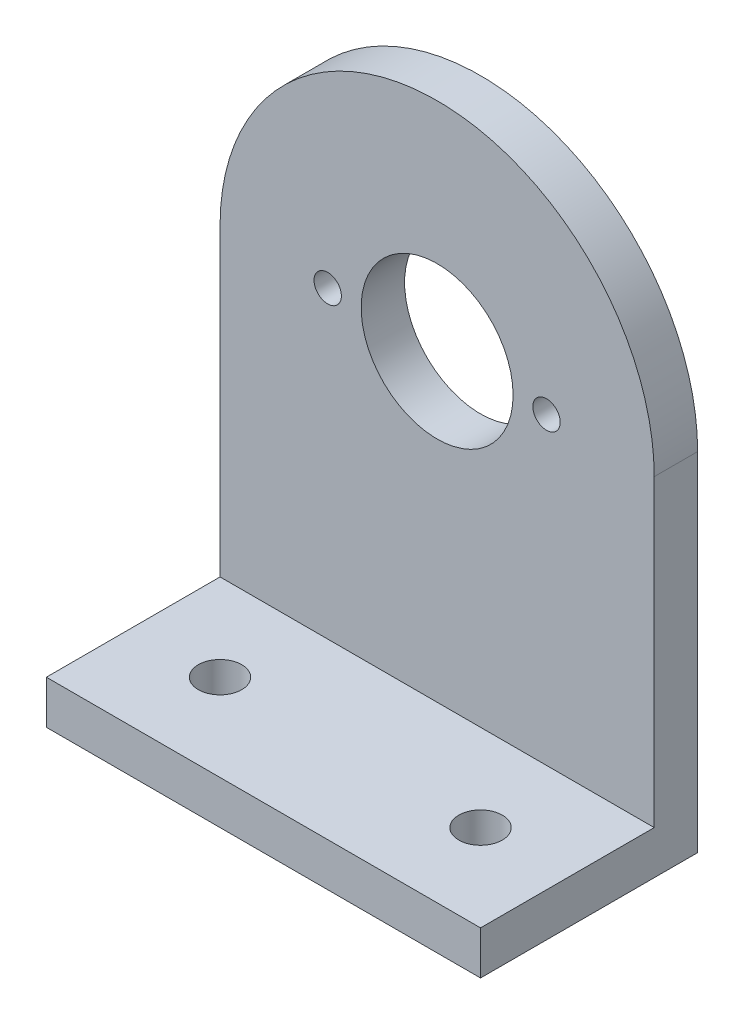
from build123d import *

# Parameters (mm, degrees)
BOSS_EXTRUDE1_DEPTH       = 3.175
SKETCH3_R                 = 5.55625
CUT_EXTRUDE1_DEPTH        = 31.120694713
SKETCH4_W                 = 31.75
SKETCH4_H                 = 3.175
BOSS_EXTRUDE2_DEPTH       = 12.7
SKETCH5_R                 = 1.5875
CUT_EXTRUDE2_DEPTH        = 45.22263278
F_2_0MM_DOWEL_HOLE1_D     = 2
F_2_0MM_DOWEL_HOLE1_DEPTH = 12.7
F_2_0MM_DOWEL_HOLE1_TIP   = 0.600860619


with BuildPart() as part:
    # Sketch1 → Boss-Extrude1 (new body)
    with BuildSketch(Plane.XY):
        with BuildLine():
            ThreePointArc((15.875, 0), (0, 15.875), (-15.875, 0))
            Line((-15.875, 0), (15.875, 0))
        make_face()
        with BuildLine():
            ThreePointArc((15.875, 0), (0, -15.875), (-15.875, 0))
            Line((-15.875, 0), (-15.875, -25.4))
            Line((-15.875, -25.4), (15.875, -25.4))
            Line((15.875, -25.4), (15.875, 0))
        make_face()
        with BuildLine():
            Line((15.875, 0), (-15.875, 0))
            ThreePointArc((-15.875, 0), (0, -15.875), (15.875, 0))
        make_face()
    extrude(amount=BOSS_EXTRUDE1_DEPTH)

    # Sketch3 → Cut-Extrude1 (cut, through all)
    with BuildSketch(Plane.XY.offset(3.175)):
        Circle(SKETCH3_R)
    extrude(amount=-CUT_EXTRUDE1_DEPTH, mode=Mode.SUBTRACT)

    # Sketch4 → Boss-Extrude2 (add)
    with BuildSketch(Plane.XY.offset(3.175)):
        with Locations((0, -23.8125)):
            Rectangle(SKETCH4_W, SKETCH4_H)
    extrude(amount=BOSS_EXTRUDE2_DEPTH)

    # Sketch5 → Cut-Extrude2 (cut, through all)
    with BuildSketch(Plane(origin=(0, -22.225, 0), x_dir=(1, 0, 0), z_dir=(0, 1, 0))):
        with Locations(Location((-9.525, -9.525, 0), (0, 0, 270))):
            Circle(SKETCH5_R)
        with Locations(Location((9.525, -9.525, 0), (0, 0, 90))):
            Circle(SKETCH5_R)
    extrude(amount=-CUT_EXTRUDE2_DEPTH, mode=Mode.SUBTRACT)

    # Ø2.0mm Dowel Hole1
    with Locations(Plane.XY.offset(3.175)):
        with Locations((-8.001, 0), (8.001, 0)):
            Hole(F_2_0MM_DOWEL_HOLE1_D / 2, depth=F_2_0MM_DOWEL_HOLE1_DEPTH)
            with Locations((0, 0, -(F_2_0MM_DOWEL_HOLE1_DEPTH + F_2_0MM_DOWEL_HOLE1_TIP / 2))):  # 118° drill point
                Cone(0, F_2_0MM_DOWEL_HOLE1_D / 2, F_2_0MM_DOWEL_HOLE1_TIP, mode=Mode.SUBTRACT)


solid = part.part
